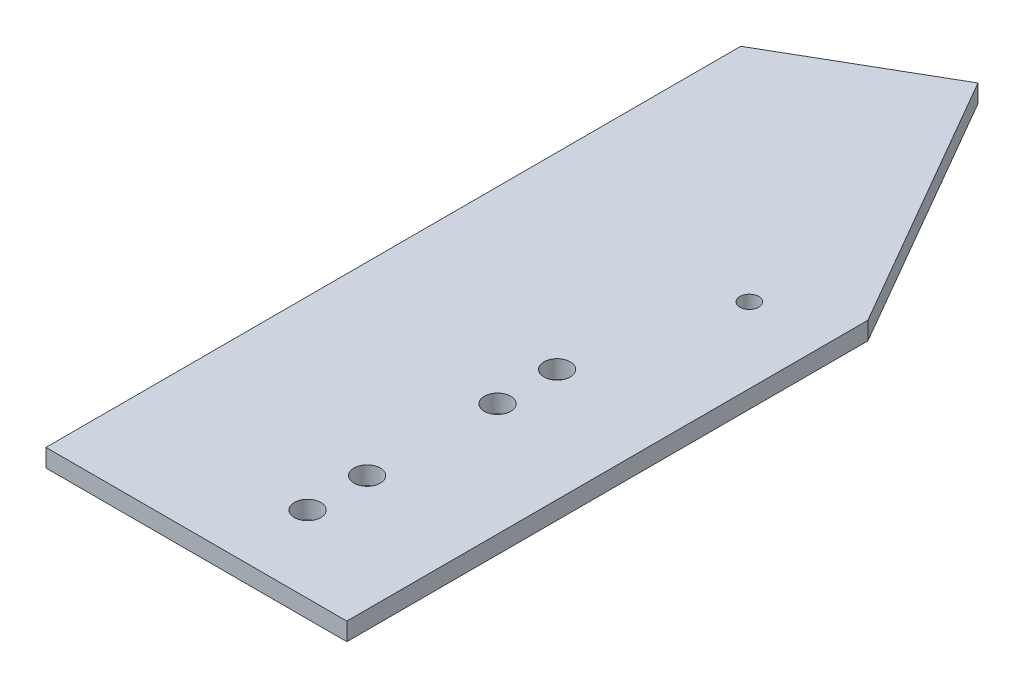
from build123d import *

# Parameters (mm, degrees)
SKETCH1_R           = 0.875
SKETCH1_R_2         = 0.625
BOSS_EXTRUDE1_DEPTH = 1.19


with BuildPart() as part:
    # Sketch1 → Boss-Extrude1 (new body)
    with BuildSketch(Plane(origin=(0, 0, 0), x_dir=(1, 0, 0), z_dir=(0, 1, 0))):
        Polygon((-120, 101.691), (-120, 55.5), (-100, 55.5), (-100, 90.144), (-110, 107.464), align=None)
        with Locations(Location((-107.5, 73.02, 0), (0, 0, 270))):
            Circle(SKETCH1_R, mode=Mode.SUBTRACT)
        with Locations(Location((-105, 87.26, 0), (0, 0, 270))):
            Circle(SKETCH1_R_2, mode=Mode.SUBTRACT)
        with Locations(Location((-107.7, 60.59, 0), (0, 0, 270))):
            Circle(SKETCH1_R, mode=Mode.SUBTRACT)
        with Locations(Location((-107.5, 76.98, 0), (0, 0, 270))):
            Circle(SKETCH1_R, mode=Mode.SUBTRACT)
        with Locations(Location((-107.7, 64.55, 0), (0, 0, 270))):
            Circle(SKETCH1_R, mode=Mode.SUBTRACT)
    extrude(amount=BOSS_EXTRUDE1_DEPTH)


solid = part.part
